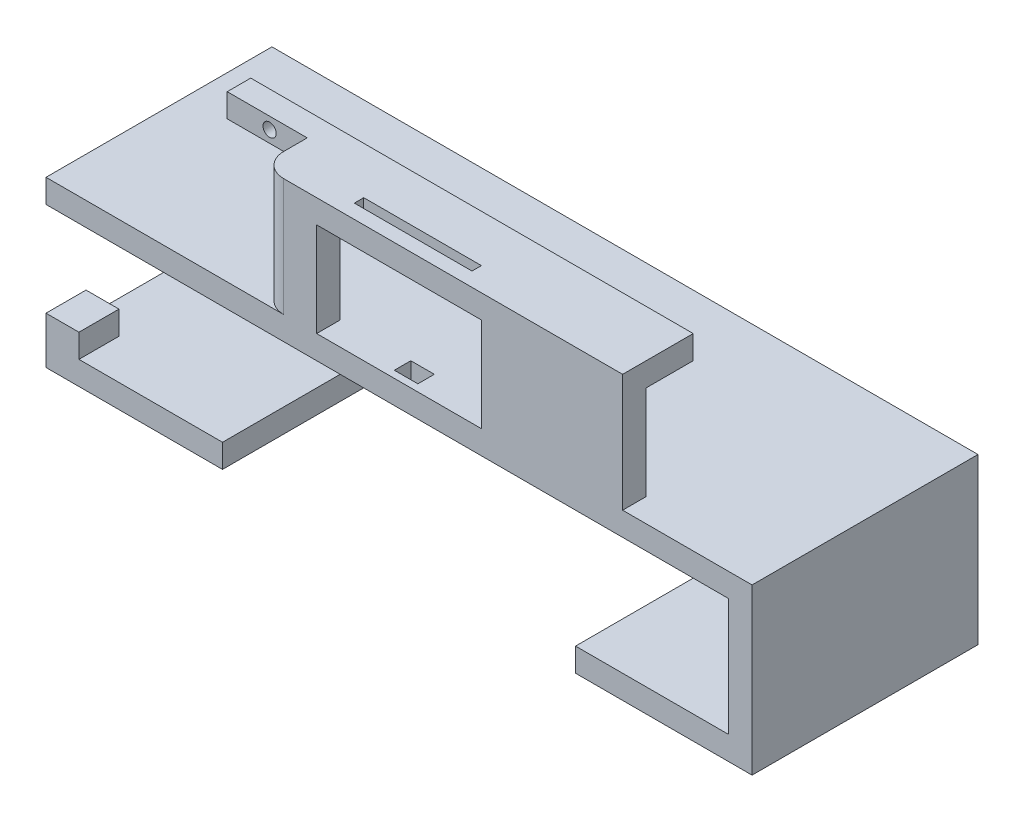
from build123d import *

# Parameters (mm, degrees)
CROQUIS1_W                  = 7.5
CROQUIS1_H                  = 15
CROQUIS1_W_2                = 95
CROQUIS1_H_2                = 3
SALIENTE_EXTRUIR1_DEPTH     = 5
CROQUIS2_W                  = 95
CROQUIS2_H                  = 3
SALIENTE_EXTRUIR2_DEPTH     = 5
CROQUIS5_W                  = 5
CROQUIS5_H                  = 15
CORTAR_EXTRUIR2_DEPTH       = 96.709194961
CROQUIS6_W                  = 5
CROQUIS6_H                  = 23
SALIENTE_EXTRUIR3_DEPTH     = 95
CROQUIS7_W                  = 35
CROQUIS7_H                  = 20
CORTAR_EXTRUIR3_DEPTH       = 52.35659646
CROQUIS9_W                  = 165
CROQUIS9_H                  = 40
SALIENTE_EXTRUIR4_DEPTH     = 50
CROQUIS15_W                 = 95
CROQUIS15_H                 = 15
SALIENTE_EXTRUIR7_DEPTH     = 2
CROQUIS16_R                 = 1.4
CORTAR_EXTRUIR7_DEPTH       = 5
CROQUIS18_W                 = 25
CROQUIS18_H                 = 2
CORTAR_EXTRUIR9_DEPTH       = 5
CORTAR_EXTRUIR10_DEPTH      = 112.719514858
CORTAR_EXTRUIR10_DEPTH_BACK = 43
CROQUIS19_W                 = 140
CROQUIS19_H                 = 25
CROQUIS20_W                 = 10
CROQUIS20_H                 = 35
CROQUIS20_H_2               = 5
CROQUIS20_W_2               = 150
CROQUIS20_W_3               = 5
CORTAR_EXTRUIR11_DEPTH      = 112.719514858
CROQUIS23_W                 = 2
CROQUIS23_H                 = 35
CORTAR_EXTRUIR12_DEPTH      = 163.346080951
CORTAR_EXTRUIR13_DEPTH      = 5
CROQUIS25_W                 = 8
CROQUIS25_H                 = 8
CROQUIS25_W_2               = 5
CROQUIS25_H_2               = 5
SALIENTE_EXTRUIR8_DEPTH     = 5
CROQUIS27_W                 = 5
CROQUIS27_H                 = 3.5
CORTAR_EXTRUIR14_DEPTH      = 5
CROQUIS28_W                 = 8.5
CROQUIS28_H                 = 10
SALIENTE_EXTRUIR9_DEPTH     = 2
CROQUIS29_W                 = 75
CROQUIS29_H                 = 30
CORTAR_EXTRUIR15_DEPTH      = 105.170533262
CROQUIS30_W                 = 8.5
CROQUIS30_H                 = 5
CORTAR_EXTRUIR16_DEPTH      = 7
CROQUIS31_W                 = 18
CROQUIS31_H                 = 25
CORTAR_EXTRUIR17_DEPTH      = 10
CROQUIS32_W                 = 5
CROQUIS32_H                 = 5
CORTAR_EXTRUIR18_DEPTH      = 1
REDONDEO4_R                 = 5


with BuildPart() as part:
    # Croquis1 → Saliente-Extruir1 (new body)
    with BuildSketch(Plane.XY):
        with Locations((43.75, 0)):
            Rectangle(CROQUIS1_W, CROQUIS1_H)
        with Locations((0, 9)):
            Rectangle(CROQUIS1_W_2, CROQUIS1_H_2)
        with Locations((-43.75, 0)):
            Rectangle(CROQUIS1_W, CROQUIS1_H)
    extrude(amount=SALIENTE_EXTRUIR1_DEPTH)

    # Croquis2 → Saliente-Extruir2 (add)
    with BuildSketch(Plane(origin=(0, 0, 0), x_dir=(-1, 0, 0), z_dir=(0, 0, -1))):
        with Locations((0, 9)):
            Rectangle(CROQUIS2_W, CROQUIS2_H)
    extrude(amount=SALIENTE_EXTRUIR2_DEPTH)

    # Croquis5 → Cortar-Extruir2 (cut, through all)
    with BuildSketch(Plane(origin=(47.5, 0, 0), x_dir=(0, 0, -1), z_dir=(1, 0, 0))):
        with Locations((-2.5, 0)):
            Rectangle(CROQUIS5_W, CROQUIS5_H)
    extrude(amount=-CORTAR_EXTRUIR2_DEPTH, mode=Mode.SUBTRACT)

    # Croquis6 → Saliente-Extruir3 (add, through all)
    with BuildSketch(Plane(origin=(47.5, 0, 0), x_dir=(0, 0, -1), z_dir=(1, 0, 0))):
        with Locations((-7.5, -1)):
            Rectangle(CROQUIS6_W, CROQUIS6_H)
    extrude(amount=-SALIENTE_EXTRUIR3_DEPTH)

    # Croquis7 → Cortar-Extruir3 (cut, through all)
    with BuildSketch(Plane.XY.offset(10)):
        with Locations((0, -2.5)):
            Rectangle(CROQUIS7_W, CROQUIS7_H)
    extrude(amount=-CORTAR_EXTRUIR3_DEPTH, mode=Mode.SUBTRACT)

    # Croquis9 → Saliente-Extruir4 (add)
    with BuildSketch(Plane.XY.offset(10)):
        with Locations((-2.5, -32.5)):
            Rectangle(CROQUIS9_W, CROQUIS9_H)
    extrude(amount=-SALIENTE_EXTRUIR4_DEPTH)

    # Croquis15 → Saliente-Extruir7 (add)
    with BuildSketch(Plane(origin=(0, 10.5, 0), x_dir=(1, 0, 0), z_dir=(0, 1, 0))):
        with Locations((0, -2.5)):
            Rectangle(CROQUIS15_W, CROQUIS15_H)
    extrude(amount=SALIENTE_EXTRUIR7_DEPTH)

    # Croquis16 → Cortar-Extruir7 (cut)
    with BuildSketch(Plane(origin=(0, 0, -5), x_dir=(-1, 0, 0), z_dir=(0, 0, -1))):
        with Locations((-37.5, 10)):
            Circle(CROQUIS16_R)
        with Locations(Location((37.5, 10, 0), (0, 0, 180))):
            Circle(CROQUIS16_R)
    extrude(amount=-CORTAR_EXTRUIR7_DEPTH, mode=Mode.SUBTRACT)

    # Croquis18 → Cortar-Extruir9 (cut)
    with BuildSketch(Plane(origin=(0, 12.5, 0), x_dir=(1, 0, 0), z_dir=(0, 1, 0))):
        with Locations((0, -6)):
            Rectangle(CROQUIS18_W, CROQUIS18_H)
    extrude(amount=-CORTAR_EXTRUIR9_DEPTH, mode=Mode.SUBTRACT)

    # Croquis19 → Cortar-Extruir10 (cut, two sides: drawn at the far end of the back side and taken through both)
    with BuildSketch(Plane.XY.offset(10).offset(-CORTAR_EXTRUIR10_DEPTH_BACK)):
        with Locations((0, -30)):
            Rectangle(CROQUIS19_W, CROQUIS19_H)
    extrude(amount=CORTAR_EXTRUIR10_DEPTH + CORTAR_EXTRUIR10_DEPTH_BACK, mode=Mode.SUBTRACT)

    # Croquis20 → Cortar-Extruir11 (cut, through all)
    with BuildSketch(Plane.XY.offset(10)):
        with Locations((-80, -30)):
            Rectangle(CROQUIS20_W, CROQUIS20_H)
        with Locations((-80, -50)):
            Rectangle(CROQUIS20_W, CROQUIS20_H_2)
        with Locations((0, -50)):
            Rectangle(CROQUIS20_W_2, CROQUIS20_H_2)
        with Locations((77.5, -50)):
            Rectangle(CROQUIS20_W_3, CROQUIS20_H_2)
        with Locations((77.5, -30)):
            Rectangle(CROQUIS20_W_3, CROQUIS20_H)
    extrude(amount=-CORTAR_EXTRUIR11_DEPTH, mode=Mode.SUBTRACT)

    # Croquis23 → Cortar-Extruir12 (cut, through all)
    with BuildSketch(Plane(origin=(75, 0, 0), x_dir=(0, 0, -1), z_dir=(1, 0, 0))):
        with Locations((39, -30)):
            Rectangle(CROQUIS23_W, CROQUIS23_H)
    extrude(amount=-CORTAR_EXTRUIR12_DEPTH, mode=Mode.SUBTRACT)

    # Croquis24 → Cortar-Extruir13 (cut)
    with BuildSketch(Plane.ZY.offset(75)):
        Polygon((10, -32.5), (10, -17.5), (-33, -17.5), (-33, -32.5), (-24.5, -32.5), (-24.5, -42.5), (1.5, -42.5), (1.5, -32.5), align=None)
    extrude(amount=-CORTAR_EXTRUIR13_DEPTH, mode=Mode.SUBTRACT)

    # Croquis25 → Saliente-Extruir8 (add, through all)
    with BuildSketch(Plane(origin=(0, -42.5, 0), x_dir=(1, 0, 0), z_dir=(0, 1, 0))):
        with Locations((0, -12.5)):
            Rectangle(CROQUIS25_W, CROQUIS25_H)
        with Locations((0, -12.5)):
            Rectangle(CROQUIS25_W_2, CROQUIS25_H_2, mode=Mode.SUBTRACT)
    extrude(amount=-SALIENTE_EXTRUIR8_DEPTH)

    # Croquis27 → Cortar-Extruir14 (cut)
    with BuildSketch(Plane(origin=(0, -12.5, 0), x_dir=(1, 0, 0), z_dir=(0, 1, 0))):
        with Locations((0, -6.75)):
            Rectangle(CROQUIS27_W, CROQUIS27_H)
    extrude(amount=-CORTAR_EXTRUIR14_DEPTH, mode=Mode.SUBTRACT)

    # Croquis28 → Saliente-Extruir9 (add)
    with BuildSketch(Plane(origin=(-70, 0, 0), x_dir=(0, 0, -1), z_dir=(1, 0, 0))):
        with Locations((-5.75, -37.5)):
            Rectangle(CROQUIS28_W, CROQUIS28_H)
        with Locations((28.75, -37.5)):
            Rectangle(CROQUIS28_W, CROQUIS28_H)
    extrude(amount=SALIENTE_EXTRUIR9_DEPTH)

    # Croquis29 → Cortar-Extruir15 (cut, through all)
    with BuildSketch(Plane.XY.offset(16.5)):
        with Locations((0, -32.5)):
            Rectangle(CROQUIS29_W, CROQUIS29_H)
    extrude(amount=-CORTAR_EXTRUIR15_DEPTH, mode=Mode.SUBTRACT)

    # Croquis30 → Cortar-Extruir16 (cut)
    with BuildSketch(Plane.ZY.offset(75)):
        with Locations((5.75, -35)):
            Rectangle(CROQUIS30_W, CROQUIS30_H)
    extrude(amount=-CORTAR_EXTRUIR16_DEPTH, mode=Mode.SUBTRACT)

    # Croquis31 → Cortar-Extruir17 (cut)
    with BuildSketch(Plane.XY.offset(10)):
        with Locations((-38.5, 0)):
            Rectangle(CROQUIS31_W, CROQUIS31_H)
    extrude(amount=-CORTAR_EXTRUIR17_DEPTH, mode=Mode.SUBTRACT)

    # Croquis32 → Cortar-Extruir18 (cut)
    with BuildSketch(Plane.ZY.offset(47.5)):
        with Locations((-2.5, 10)):
            Rectangle(CROQUIS32_W, CROQUIS32_H)
    extrude(amount=-CORTAR_EXTRUIR18_DEPTH, mode=Mode.SUBTRACT)

    # Redondeo4
    redondeo4_edges = [part.edges().sort_by_distance(p)[0] for p in [
        (-29.5, 0, 10),
    ]]
    fillet(redondeo4_edges, radius=REDONDEO4_R)


solid = part.part
